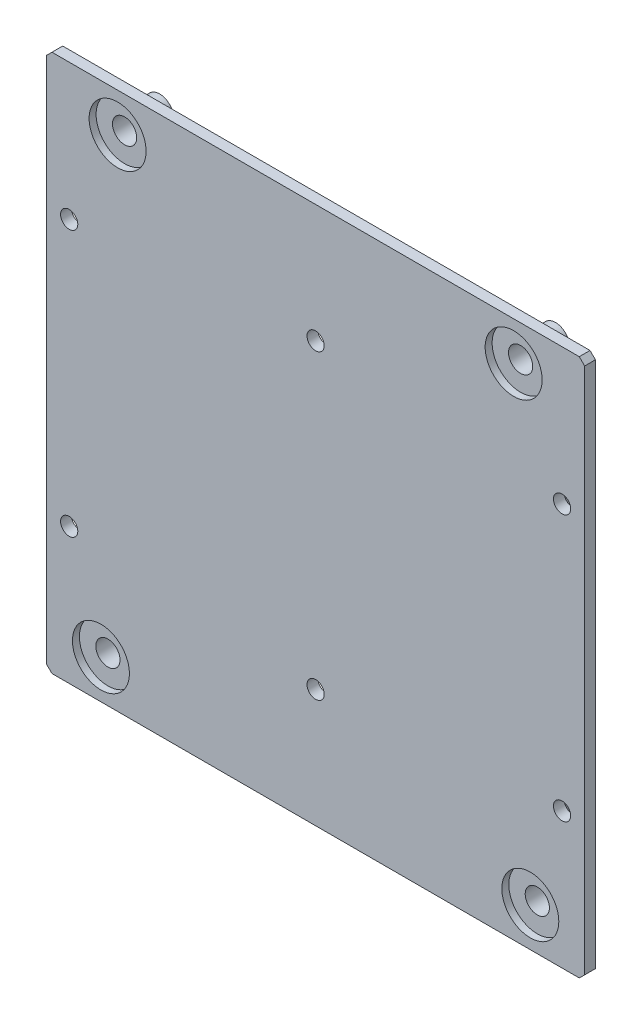
from build123d import *

# Parameters (mm, degrees)
SKETCH1_W           = 100
SKETCH1_H           = 100
BOSS_EXTRUDE1_DEPTH = 2
CHAMFER1_SIZE       = 1
SKETCH2_W           = 85.6
SKETCH2_H           = 85.6
SKETCH2_W_2         = 81.6
SKETCH2_H_2         = 81.6
EXTRUDE_THIN1_DEPTH = 3
BOSS_EXTRUDE2_DEPTH = 5.8
HOLE1_D             = 4.5
HOLE1_CBORE_D       = 10.59
HOLE1_CBORE_DEPTH   = 1.3
SKETCH6_R           = 3.5
BOSS_EXTRUDE3_DEPTH = 5
SKETCH10_R          = 1.6
CUT_EXTRUDE2_DEPTH  = 142.636294784
SKETCH7_W           = 81.6
SKETCH7_H           = 1.5
SKETCH7_W_2         = 1.5
SKETCH7_H_2         = 82.87
SKETCH7_H_3         = 83
EXTRUDE_THIN2_DEPTH = 3
SKETCH9_R           = 2
CUT_EXTRUDE1_DEPTH  = 5


with BuildPart() as part:
    # Sketch1 → Boss-Extrude1 (new body)
    with BuildSketch(Plane(origin=(0, 0, 0), x_dir=(0, 1, 0), z_dir=(0, 0, 1))):
        with Locations((50, 50)):
            Rectangle(SKETCH1_W, SKETCH1_H)
    extrude(amount=BOSS_EXTRUDE1_DEPTH)

    # Chamfer1
    chamfer1_edges = [part.edges().sort_by_distance(p)[0] for p in [
        (-100, 0, 1),
        (-100, 100, 1),
        (0, 100, 1),
        (0, 0, 1),
    ]]
    chamfer(chamfer1_edges, length=CHAMFER1_SIZE)

    # Sketch2 → Extrude-Thin1 (add)
    with BuildSketch(Plane(origin=(0, 0, 0), x_dir=(1, 0, 0), z_dir=(0, 0, -1))):
        with Locations((-50, -50)):
            Rectangle(SKETCH2_W, SKETCH2_H)
        with Locations((-50, -50)):
            Rectangle(SKETCH2_W_2, SKETCH2_H_2, mode=Mode.SUBTRACT)
    extrude(amount=EXTRUDE_THIN1_DEPTH)

    # Sketch3 → Boss-Extrude2 (add)
    with BuildSketch(Plane(origin=(0, 0, 0), x_dir=(1, 0, 0), z_dir=(0, 0, -1))):
        with BuildLine():
            Line((-7.2, -89.4), (-7.2, -92.8))
            Line((-7.2, -92.8), (-10.616961477, -92.8))
            ThreePointArc((-10.616961477, -92.8), (-13.215037689, -95.5), (-15.8131139, -92.8))
            Line((-15.8131139, -92.8), (-16.6, -92.8))
            Line((-16.6, -92.8), (-16.6, -92.4))
            ThreePointArc((-16.6, -92.4), (-15.721320344, -90.278679656), (-13.6, -89.4))
            Line((-13.6, -89.4), (-7.2, -89.4))
        make_face()
        with BuildLine():
            Line((-14, -7.2), (-12.9, -7.2))
            ThreePointArc((-12.9, -7.2), (-9.552180018, -4.561843457), (-6.780517921, -7.8))
            ThreePointArc((-6.780517921, -7.8), (-6.896556217, -8.819653311), (-7.2, -9.8))
            Line((-7.2, -9.8), (-7.2, -10.6))
            Line((-7.2, -10.6), (-11, -10.6))
            ThreePointArc((-11, -10.6), (-13.121320344, -9.721320344), (-14, -7.6))
            Line((-14, -7.6), (-14, -7.2))
        make_face()
    boss_extrude2 = extrude(amount=BOSS_EXTRUDE2_DEPTH)

    # Hole1 (through all)
    with Locations(Plane.XY.offset(2)):
        with Locations((-13.2, 92.8), (-10.1, 7.2)):
            hole1 = CounterBoreHole(HOLE1_D / 2, HOLE1_CBORE_D / 2, HOLE1_CBORE_DEPTH)

    # Mirror1: Boss-Extrude2, Hole1 across plane
    add(boss_extrude2.mirror(Plane(origin=(-50, 0, 0), x_dir=(0, 0, 1), z_dir=(1, 0, 0))))
    add(hole1.mirror(Plane(origin=(-50, 0, 0), x_dir=(0, 0, 1), z_dir=(1, 0, 0))), mode=Mode.SUBTRACT)

    # Sketch6 → Boss-Extrude3 (add)
    with BuildSketch(Plane(origin=(0, 0, 0), x_dir=(1, 0, 0), z_dir=(0, 0, -1))):
        with Locations(Location((-71.1, -88.57, 0), (0, 0, 320.420902018))):
            Circle(SKETCH6_R)
        with Locations(Location((-71.1, -57.67, 0), (0, 0, 180))):
            Circle(SKETCH6_R)
        with Locations(Location((-30.4, -57.67, 0), (0, 0, 180))):
            Circle(SKETCH6_R)
        with Locations(Location((-30.4, -88.57, 0), (0, 0, 320.420902018))):
            Circle(SKETCH6_R)
        with Locations(Location((-22.4, -48.3, 0), (0, 0, 180))):
            Circle(SKETCH6_R)
        with Locations(Location((-60.4, -48.3, 0), (0, 0, 180))):
            Circle(SKETCH6_R)
        with Locations(Location((-60.4, -11.3, 0), (0, 0, 36.869897646))):
            Circle(SKETCH6_R)
        with Locations(Location((-22.4, -11.3, 0), (0, 0, 36.869897646))):
            Circle(SKETCH6_R)
    extrude(amount=BOSS_EXTRUDE3_DEPTH)

    # Sketch10 → Cut-Extrude2 (cut, through all)
    with BuildSketch(Plane.XY.offset(2)):
        with Locations((-50, 78.05)):
            Circle(SKETCH10_R)
        with Locations((-4.2, 74.7)):
            Circle(SKETCH10_R)
        with Locations((-95.8, 74.7)):
            Circle(SKETCH10_R)
        with Locations(Location((-95.8, 25.3, 0), (0, 0, 180))):
            Circle(SKETCH10_R)
        with Locations(Location((-4.2, 25.3, 0), (0, 0, 180))):
            Circle(SKETCH10_R)
        with Locations(Location((-50, 21.95, 0), (0, 0, 180))):
            Circle(SKETCH10_R)
    extrude(amount=-CUT_EXTRUDE2_DEPTH, mode=Mode.SUBTRACT)

    # Sketch7 → Extrude-Thin2 (add)
    with BuildSketch(Plane(origin=(0, 0, 0), x_dir=(1, 0, 0), z_dir=(0, 0, -1))):
        with Locations((-50, -48.3)):
            Rectangle(SKETCH7_W, SKETCH7_H)
        with Locations((-30.4, -50.635)):
            Rectangle(SKETCH7_W_2, SKETCH7_H_2)
        with Locations((-22.4, -49.3)):
            Rectangle(SKETCH7_W_2, SKETCH7_H_3)
        with Locations((-50, -57.67)):
            Rectangle(SKETCH7_W, SKETCH7_H)
        with Locations((-71.1, -50.635)):
            Rectangle(SKETCH7_W_2, SKETCH7_H_2)
        with Locations((-60.4, -49.3)):
            Rectangle(SKETCH7_W_2, SKETCH7_H_3)
        with Locations((-50, -70.67)):
            Rectangle(SKETCH7_W, SKETCH7_H)
        with Locations((-50, -30.3)):
            Rectangle(SKETCH7_W, SKETCH7_H)
    extrude(amount=EXTRUDE_THIN2_DEPTH)

    # Sketch9 → Cut-Extrude1 (cut)
    with BuildSketch(Plane(origin=(0, 0, -5), x_dir=(1, 0, 0), z_dir=(0, 0, -1))):
        with Locations(Location((-60.4, -11.3, 0), (0, 0, 180))):
            Circle(SKETCH9_R)
        with Locations(Location((-22.4, -11.3, 0), (0, 0, 180))):
            Circle(SKETCH9_R)
        with Locations(Location((-22.4, -48.3, 0), (0, 0, 180))):
            Circle(SKETCH9_R)
        with Locations(Location((-30.4, -57.67, 0), (0, 0, 180))):
            Circle(SKETCH9_R)
        with Locations(Location((-60.4, -48.3, 0), (0, 0, 180))):
            Circle(SKETCH9_R)
        with Locations(Location((-71.1, -88.57, 0), (0, 0, 180))):
            Circle(SKETCH9_R)
        with Locations(Location((-30.4, -88.57, 0), (0, 0, 180))):
            Circle(SKETCH9_R)
        with Locations(Location((-71.1, -57.67, 0), (0, 0, 180))):
            Circle(SKETCH9_R)
    extrude(amount=-CUT_EXTRUDE1_DEPTH, mode=Mode.SUBTRACT)


solid = part.part
